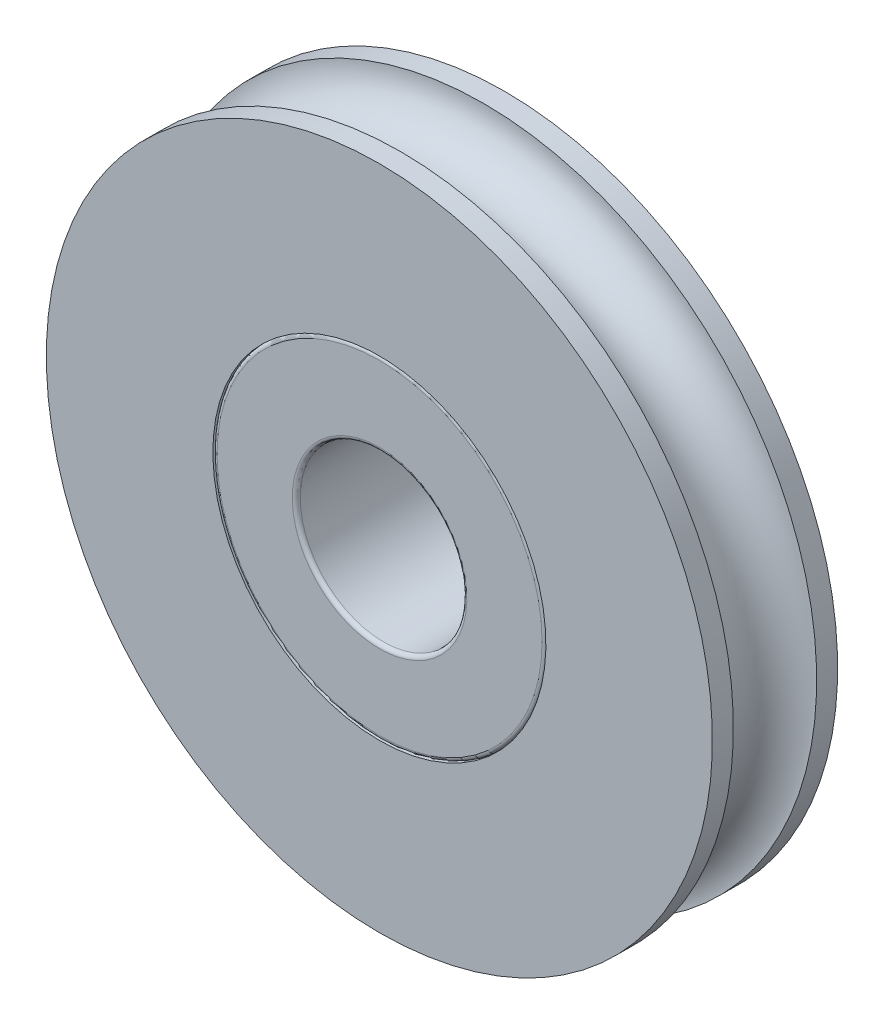
from build123d import *

# Parameters (mm, degrees)
SKETCH2_W = 4.7625
SKETCH2_H = 3.175
FILLET1_R = 0.1524


with BuildPart() as part:
    # Sketch1 → Revolve1 (revolve)
    with BuildSketch(Plane(origin=(0, 0, 0), x_dir=(0, 0, -1), z_dir=(1, 0, 0)), mode=Mode.PRIVATE) as revolve1_sk:
        with BuildLine():
            Line((3.968292734, 12.7), (4.76885, 12.7))
            Line((4.76885, 12.7), (4.76885, 6.35))
            Line((4.76885, 6.35), (-0.00635, 6.35))
            Line((-0.00635, 6.35), (-0.00635, 12.7))
            Line((-0.00635, 12.7), (0.794207266, 12.7))
            ThreePointArc((0.794207266, 12.7), (2.38125, 11.0744), (3.968292734, 12.7))
        make_face()
    revolve(revolve1_sk.sketch.rotate(Axis((0, 0, 0), (0, 0, -1)), 180), axis=Axis((0, 0, 0), (0, 0, -1)))


with BuildPart() as body_2:
    # Sketch2 → Revolve2 (revolve)
    with BuildSketch(Plane(origin=(0, 0, 0), x_dir=(0, 0, -1), z_dir=(1, 0, 0)), mode=Mode.PRIVATE) as revolve2_sk:
        with Locations((2.38125, 4.7625)):
            Rectangle(SKETCH2_W, SKETCH2_H)
    revolve(revolve2_sk.sketch.rotate(Axis((0, 0, 0), (0, 0, -1)), 180), axis=Axis((0, 0, 0), (0, 0, -1)))

    # Fillet1
    fillet1_edges = [body_2.edges().sort_by_distance(p)[0] for p in [
        (0, 6.35, 0),
        (0, 6.35, -4.7625),
        (0, 3.175, -4.7625),
        (0, 3.175, 0),
    ]]
    fillet(fillet1_edges, radius=FILLET1_R)


solid = Compound([part.part, body_2.part])
